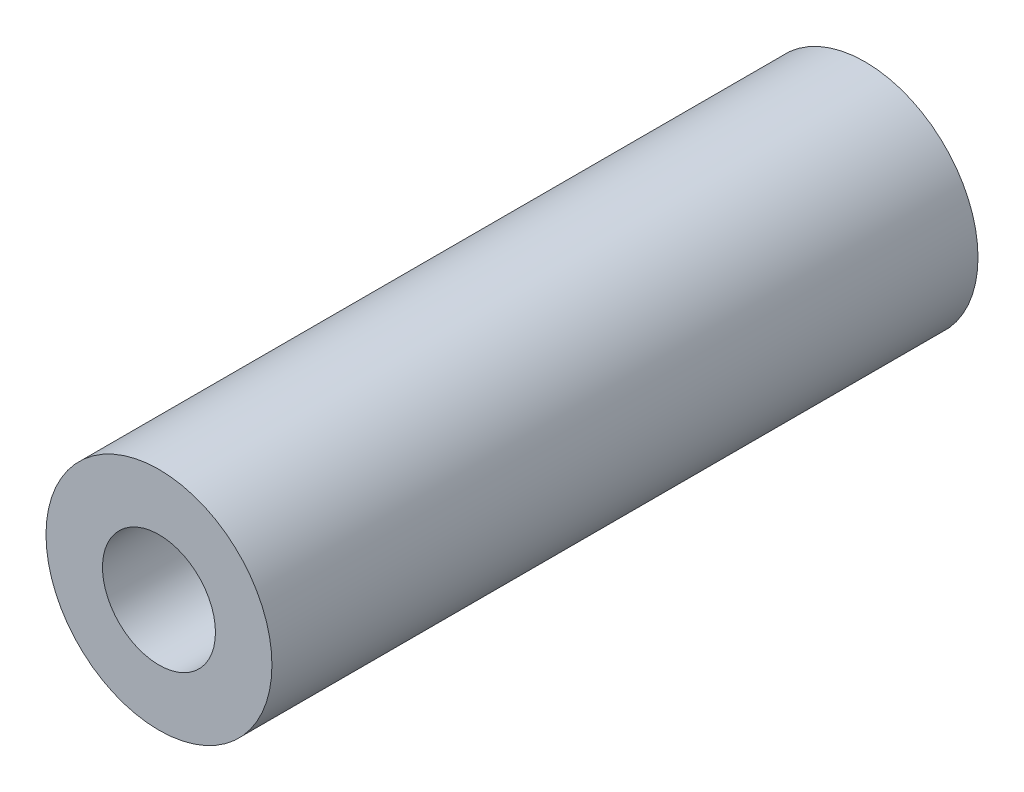
from build123d import *

# Parameters (mm, degrees)
SKETCH1_R           = 5.08
SKETCH1_R_2         = 2.54
BOSS_EXTRUDE1_DEPTH = 31.75


with BuildPart() as part:
    # Sketch1 → Boss-Extrude1 (new body)
    with BuildSketch(Plane.XY):
        Circle(SKETCH1_R)
        Circle(SKETCH1_R_2, mode=Mode.SUBTRACT)
    extrude(amount=BOSS_EXTRUDE1_DEPTH)


solid = part.part
